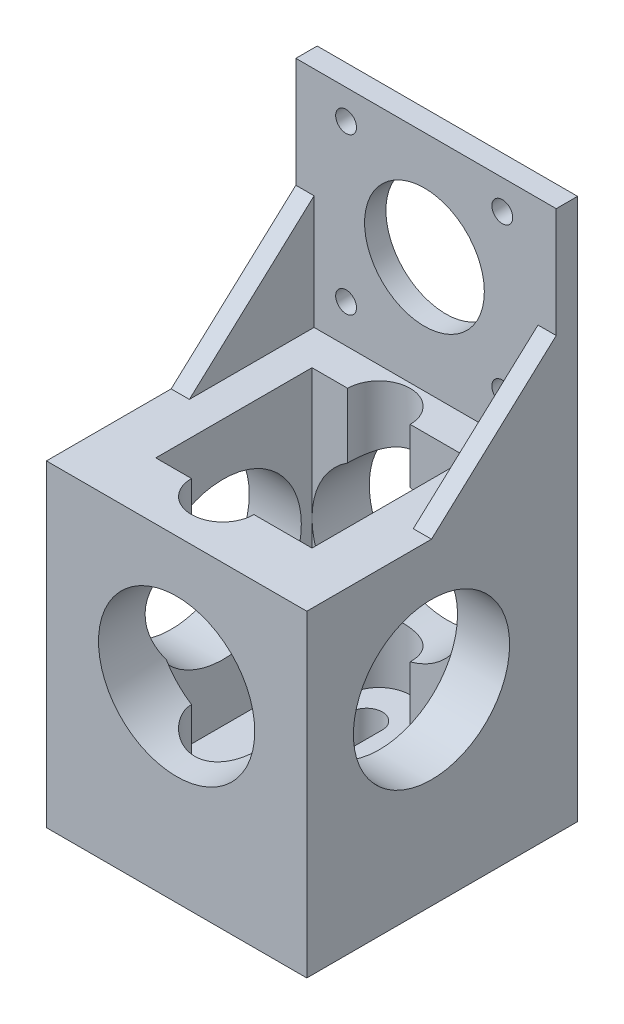
from build123d import *

# Parameters (mm, degrees)
SKETCH1_W           = 50
SKETCH1_H           = 52
BOSS_EXTRUDE1_DEPTH = 61
SKETCH2_W           = 30
SKETCH2_H           = 30
CUT_EXTRUDE1_DEPTH  = 51
CUT_EXTRUDE2_DEPTH  = 75
CUT_EXTRUDE3_DEPTH  = 51
SKETCH6_W           = 50
SKETCH6_H           = 4.1
BOSS_EXTRUDE2_DEPTH = 43
SKETCH8_R           = 11.5
SKETCH8_R_2         = 2
CUT_EXTRUDE4_DEPTH  = 43
BOSS_EXTRUDE3_DEPTH = 3.5
BOSS_EXTRUDE4_DEPTH = 3.5
SKETCH11_R          = 15
CUT_EXTRUDE5_DEPTH  = 98.5
SKETCH12_R          = 15
CUT_EXTRUDE6_DEPTH  = 98.5


with BuildPart() as part:
    # Sketch1 → Boss-Extrude1 (new body)
    with BuildSketch(Plane(origin=(0, 0, 0), x_dir=(1, 0, 0), z_dir=(0, 1, 0))):
        Rectangle(SKETCH1_W, SKETCH1_H)
    extrude(amount=BOSS_EXTRUDE1_DEPTH)

    # Sketch2 → Cut-Extrude1 (cut)
    with BuildSketch(Plane(origin=(0, 61, 0), x_dir=(1, 0, 0), z_dir=(0, 1, 0))):
        Rectangle(SKETCH2_W, SKETCH2_H)
    extrude(amount=-CUT_EXTRUDE1_DEPTH, mode=Mode.SUBTRACT)

    # Sketch3 → Cut-Extrude2 (cut, symmetric)
    with BuildSketch(Plane(origin=(0, 10, 0), x_dir=(1, 0, 0), z_dir=(0, 1, 0))):
        with BuildLine():
            Line((1, 12.5), (1, -12.5))
            ThreePointArc((1, -12.5), (-2, -15.5), (-5, -12.5))
            Line((-5, -12.5), (-5, 12.5))
            ThreePointArc((-5, 12.5), (-2, 15.5), (1, 12.5))
        make_face()
    extrude(amount=CUT_EXTRUDE2_DEPTH, both=True, mode=Mode.SUBTRACT)

    # Sketch5 → Cut-Extrude3 (cut)
    with BuildSketch(Plane(origin=(0, 61, 0), x_dir=(1, 0, 0), z_dir=(0, 1, 0))):
        with BuildLine():
            Line((3.852906206, 15), (3.852906206, -15))
            ThreePointArc((3.852906206, -15), (-2.147093794, -21), (-8.147093794, -15))
            Line((-8.147093794, -15), (-8.147093794, 15))
            ThreePointArc((-8.147093794, 15), (-2.147093794, 21), (3.852906206, 15))
        make_face()
    extrude(amount=-CUT_EXTRUDE3_DEPTH, mode=Mode.SUBTRACT)

    # Sketch6 → Boss-Extrude2 (add)
    with BuildSketch(Plane(origin=(0, 61, 0), x_dir=(1, 0, 0), z_dir=(0, 1, 0))):
        with Locations((0, 23.95)):
            Rectangle(SKETCH6_W, SKETCH6_H)
    extrude(amount=BOSS_EXTRUDE2_DEPTH)

    # Sketch8 → Cut-Extrude4 (cut)
    with BuildSketch(Plane.XY.offset(-21.9)):
        with Locations((-0.305876732, 83.277637399)):
            Circle(SKETCH8_R)
        with Locations((-15.355876732, 68.327637399)):
            Circle(SKETCH8_R_2)
        with Locations((-15.355876732, 98.327637399)):
            Circle(SKETCH8_R_2)
        with Locations((14.644123268, 68.327637399)):
            Circle(SKETCH8_R_2)
        with Locations((14.644123268, 98.327637399)):
            Circle(SKETCH8_R_2)
    extrude(amount=-CUT_EXTRUDE4_DEPTH, mode=Mode.SUBTRACT)

    # Sketch9 → Boss-Extrude3 (add)
    with BuildSketch(Plane.ZY.offset(25)):
        Polygon((-21.9, 61), (2.05, 61), (-21.9, 82.893920103), align=None)
    extrude(amount=-BOSS_EXTRUDE3_DEPTH)

    # Sketch10 → Boss-Extrude4 (add)
    with BuildSketch(Plane(origin=(25, 0, 0), x_dir=(0, 0, -1), z_dir=(1, 0, 0))):
        Polygon((21.9, 61), (-2.05, 61), (21.9, 82.893920103), align=None)
    extrude(amount=-BOSS_EXTRUDE4_DEPTH)

    # Sketch11 → Cut-Extrude5 (cut)
    with BuildSketch(Plane.XY.offset(26)):
        with Locations((0, 36)):
            Circle(SKETCH11_R)
    extrude(amount=-CUT_EXTRUDE5_DEPTH, mode=Mode.SUBTRACT)

    # Sketch12 → Cut-Extrude6 (cut)
    with BuildSketch(Plane(origin=(25, 0, 0), x_dir=(0, 0, -1), z_dir=(1, 0, 0))):
        with Locations((-2.05, 36)):
            Circle(SKETCH12_R)
    extrude(amount=-CUT_EXTRUDE6_DEPTH, mode=Mode.SUBTRACT)


solid = part.part
